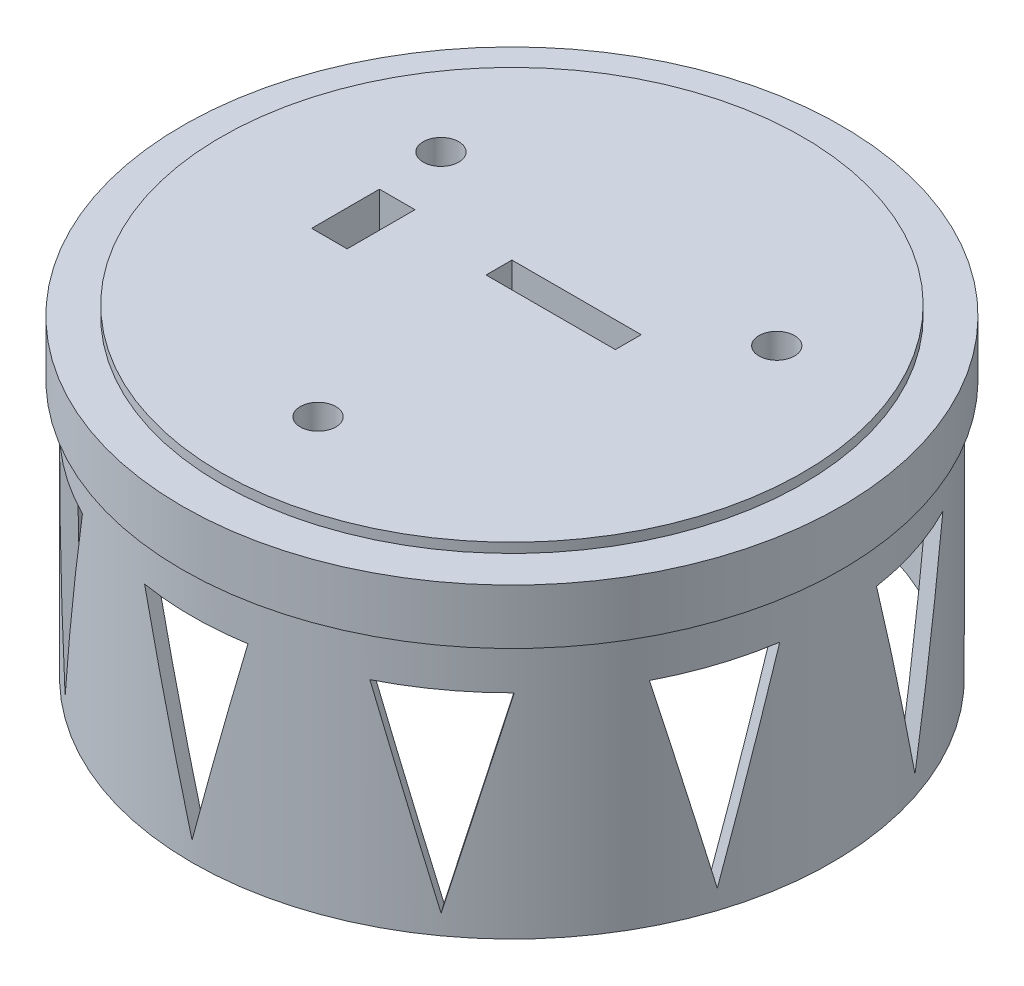
from build123d import *

# Parameters (mm, degrees)
CUT_EXTRUDE_578_DEPTH      = 70.85
PATTERN_CIRCULAR_632_COUNT = 5
SKETCH_7_R                 = 51
EXTRUDE_1_DEPTH            = 10
CUT_EXTRUDE_START          = -1.5
SKETCH_8_R                 = 51
SKETCH_8_R_2               = 45
CUT_EXTRUDE_1_DEPTH        = 1.5
SKETCH_10_R                = 2.75
CUT_EXTRUDE_5_DEPTH        = 8
CUT_EXTRUDE_6_REACH        = 89.761
SKETCH_11_W                = 20
SKETCH_11_H                = 4
SKETCH_11_W_2              = 5.5
SKETCH_11_H_2              = 10.5


with BuildPart() as part:
    # Эскиз2 → Revolve 375 (revolve)
    with BuildSketch(Plane.XY, mode=Mode.PRIVATE) as revolve_375_sk:
        with BuildLine():
            Line((0, 0), (-49.5, 0))
            Line((-49.5, 0), (-49.5, -40))
            Line((-49.5, -40), (-47.5, -40))
            Line((-47.5, -40), (-47.5, -5.5))
            ThreePointArc((-47.5, -5.5), (-46.621320344, -3.378679656), (-44.5, -2.5))
            Line((-44.5, -2.5), (0, -2.5))
            Line((0, -2.5), (0, 0))
        make_face()
    revolve(revolve_375_sk.sketch.rotate(Axis((0, 0, 0), (0, 1, 0)), 270), axis=Axis((0, 0, 0), (0, 1, 0)))

    # Эскиз4 → Cut-Extrude 578 (cut, symmetric)
    with BuildSketch(Plane.XY):
        Polygon((-8, -7), (8, -7), (0, -37), align=None)
    cut_extrude_578 = extrude(amount=CUT_EXTRUDE_578_DEPTH, both=True, mode=Mode.SUBTRACT)

    # Pattern Circular 632: Cut-Extrude 578 ×5 about axis
    pattern_circular_632_axis = Axis((0, 0, 0), (0, 1, 0))
    for i in range(1, PATTERN_CIRCULAR_632_COUNT):
        add(cut_extrude_578.rotate(pattern_circular_632_axis, i * 360 / PATTERN_CIRCULAR_632_COUNT), mode=Mode.SUBTRACT)

    # Эскиз7 → Бобышка-Вытянуть1 (add)
    with BuildSketch(Plane(origin=(0, 0, 0), x_dir=(1, 0, 0), z_dir=(0, 1, 0))):
        with Locations(Location((0, 0, 0), (0, 0, 270))):
            Circle(SKETCH_7_R)
    extrude(amount=EXTRUDE_1_DEPTH)

    # Эскиз8 → Вырез-Вытянуть1 (cut)
    with BuildSketch(Plane(origin=(0, 10, 0), x_dir=(1, 0, 0), z_dir=(0, 1, 0)).offset(CUT_EXTRUDE_START)):
        with Locations(Location((0, 0, 0), (0, 0, 270))):
            Circle(SKETCH_8_R)
        with Locations(Location((0, 0, 0), (0, 0, 270))):
            Circle(SKETCH_8_R_2, mode=Mode.SUBTRACT)
    extrude(amount=CUT_EXTRUDE_1_DEPTH, mode=Mode.SUBTRACT)

    # Эскиз10 → Вырез-Вытянуть5 (cut)
    with BuildSketch(Plane(origin=(0, 10, 0), x_dir=(1, 0, 0), z_dir=(0, 1, 0))):
        with Locations(Location((0, -30, 0), (0, 0, 270))):
            Circle(SKETCH_10_R)
        with Locations(Location((-25.980762114, 15, 0), (0, 0, 270))):
            Circle(SKETCH_10_R)
        with Locations(Location((25.980762114, 15, 0), (0, 0, 270))):
            Circle(SKETCH_10_R)
    extrude(amount=-CUT_EXTRUDE_5_DEPTH, mode=Mode.SUBTRACT)

    # Эскиз11 → Вырез-Вытянуть6 (cut, up to next)
    with BuildSketch(Plane(origin=(0, 10, 0), x_dir=(1, 0, 0), z_dir=(0, 1, 0)), mode=Mode.PRIVATE) as cut_extrude_6_sk1:
        with Locations((4, 4)):
            Rectangle(SKETCH_11_W, SKETCH_11_H)
    cut_extrude_6_tool1 = extrude(cut_extrude_6_sk1.sketch, amount=-CUT_EXTRUDE_6_REACH, mode=Mode.PRIVATE) & part.part
    # Эскиз11 → Вырез-Вытянуть6 (cut, up to next)
    with BuildSketch(Plane(origin=(0, 10, 0), x_dir=(1, 0, 0), z_dir=(0, 1, 0)), mode=Mode.PRIVATE) as cut_extrude_6_sk2:
        with Locations((-23, 0)):
            Rectangle(SKETCH_11_W_2, SKETCH_11_H_2)
    cut_extrude_6_tool2 = extrude(cut_extrude_6_sk2.sketch, amount=-CUT_EXTRUDE_6_REACH, mode=Mode.PRIVATE) & part.part
    add(cut_extrude_6_tool1.solids().sort_by_distance((4, 10, -4))[0], mode=Mode.SUBTRACT)
    add(cut_extrude_6_tool2.solids().sort_by_distance((-23, 10, 0))[0], mode=Mode.SUBTRACT)


solid = part.part
